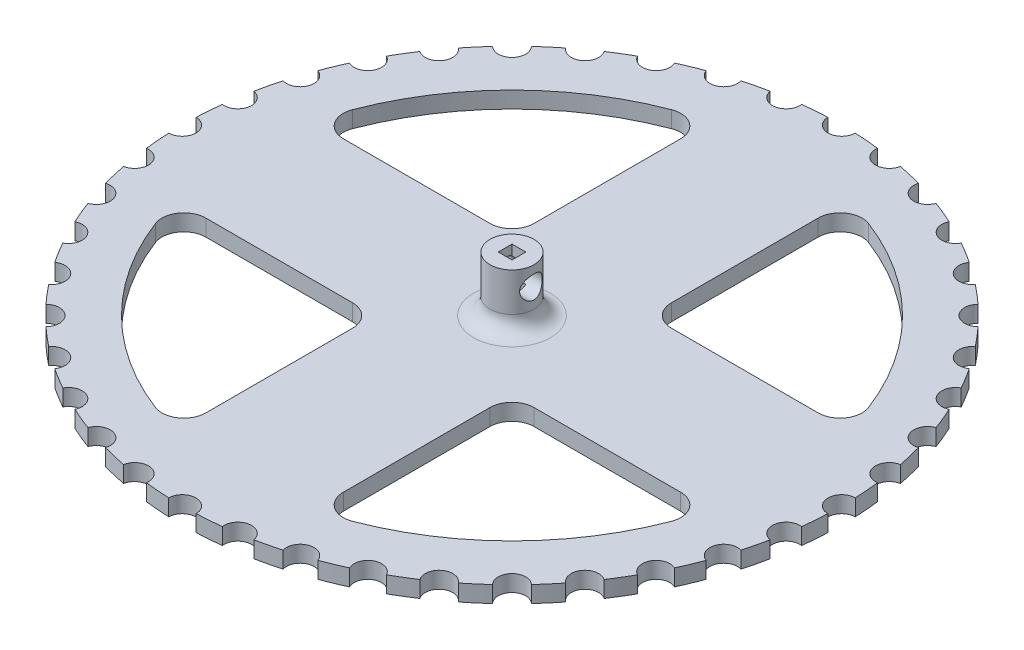
from build123d import *

# Parameters (mm, degrees)
SKETCH1_R           = 76.2
SKETCH1_R_2         = 63.804564168
SKETCH1_R_3         = 15.875
SKETCH1_W           = 3.175
SKETCH1_H           = 3.175
BOSS_EXTRUDE1_DEPTH = 3.81
FILLET1_R           = 5.08
SKETCH2_R           = 5.08
SKETCH2_W           = 3.175
SKETCH2_H           = 3.175
BOSS_EXTRUDE2_DEPTH = 12.7
FILLET2_R           = 3.81
SKETCH3_R           = 2.6
CUT_EXTRUDE1_DEPTH  = 12.7
SKETCH4_R           = 3.175
CUT_EXTRUDE2_DEPTH  = 12.7


with BuildPart() as part:
    # Sketch1 → Boss-Extrude1 (new body)
    # profile 1 of 10: a face of its own
    with BuildSketch(Plane(origin=(0, 0, 0), x_dir=(1, 0, 0), z_dir=(0, 1, 0))):
        with Locations(Location((0, 0, 0), (0, 0, 90))):
            Circle(SKETCH1_R)
        Circle(SKETCH1_R_2, mode=Mode.SUBTRACT)
    # profile 2 of 10: a face of its own
    with BuildSketch(Plane(origin=(0, 0, 0), x_dir=(1, 0, 0), z_dir=(0, 1, 0))):
        with BuildLine():
            Line((-15.875, -15.875), (-15.875, 0))
            Line((-15.875, 0), (-15.875, 15.875))
            Line((-15.875, 15.875), (-61.798113108, 15.875))
            ThreePointArc((-61.798113108, 15.875), (-63.804564168, 0), (-61.798113108, -15.875))
            Line((-61.798113108, -15.875), (-15.875, -15.875))
        make_face()
    # profile 3 of 10: a face of its own
    with BuildSketch(Plane(origin=(0, 0, 0), x_dir=(1, 0, 0), z_dir=(0, 1, 0))):
        with BuildLine():
            Line((0, -15.875), (-15.875, -15.875))
            Line((-15.875, -15.875), (-15.875, -61.798113108))
            ThreePointArc((-15.875, -61.798113108), (0, -63.804564168), (15.875, -61.798113108))
            Line((15.875, -61.798113108), (15.875, -15.875))
            Line((15.875, -15.875), (0, -15.875))
        make_face()
    # profile 4 of 10: a face of its own
    with BuildSketch(Plane(origin=(0, 0, 0), x_dir=(1, 0, 0), z_dir=(0, 1, 0))):
        with BuildLine():
            Line((-15.875, 61.798113108), (-15.875, 15.875))
            Line((-15.875, 15.875), (0, 15.875))
            Line((0, 15.875), (15.875, 15.875))
            Line((15.875, 15.875), (15.875, 61.798113108))
            ThreePointArc((15.875, 61.798113108), (0, 63.804564168), (-15.875, 61.798113108))
        make_face()
    # profile 5 of 10: a face of its own
    with BuildSketch(Plane(origin=(0, 0, 0), x_dir=(1, 0, 0), z_dir=(0, 1, 0))):
        with BuildLine():
            Line((61.798113108, 15.875), (15.875, 15.875))
            Line((15.875, 15.875), (15.875, 0))
            Line((15.875, 0), (15.875, -15.875))
            Line((15.875, -15.875), (61.798113108, -15.875))
            ThreePointArc((61.798113108, -15.875), (63.300963982, -8.000647956), (63.804564168, 0))
            ThreePointArc((63.804564168, 0), (63.300963982, 8.000647956), (61.798113108, 15.875))
        make_face()
    # profile 6 of 10: a face of its own
    with BuildSketch(Plane(origin=(0, 0, 0), x_dir=(1, 0, 0), z_dir=(0, 1, 0))):
        with BuildLine():
            Line((-15.875, 15.875), (-15.875, 0))
            ThreePointArc((-15.875, 0), (-11.225320151, 11.225320151), (0, 15.875))
            Line((0, 15.875), (-15.875, 15.875))
        make_face()
    # profile 7 of 10: a face of its own
    with BuildSketch(Plane(origin=(0, 0, 0), x_dir=(1, 0, 0), z_dir=(0, 1, 0))):
        Circle(SKETCH1_R_3)
        Rectangle(SKETCH1_W, SKETCH1_H, mode=Mode.SUBTRACT)
    # profile 8 of 10: a face of its own
    with BuildSketch(Plane(origin=(0, 0, 0), x_dir=(1, 0, 0), z_dir=(0, 1, 0))):
        with BuildLine():
            ThreePointArc((0, -15.875), (-11.225320151, -11.225320151), (-15.875, 0))
            Line((-15.875, 0), (-15.875, -15.875))
            Line((-15.875, -15.875), (0, -15.875))
        make_face()
    # profile 9 of 10: a face of its own
    with BuildSketch(Plane(origin=(0, 0, 0), x_dir=(1, 0, 0), z_dir=(0, 1, 0))):
        with BuildLine():
            ThreePointArc((15.875, 0), (11.225320151, -11.225320151), (0, -15.875))
            Line((0, -15.875), (15.875, -15.875))
            Line((15.875, -15.875), (15.875, 0))
        make_face()
    # profile 10 of 10: a face of its own
    with BuildSketch(Plane(origin=(0, 0, 0), x_dir=(1, 0, 0), z_dir=(0, 1, 0))):
        with BuildLine():
            Line((15.875, 15.875), (0, 15.875))
            ThreePointArc((0, 15.875), (11.225320151, 11.225320151), (15.875, 0))
            Line((15.875, 0), (15.875, 15.875))
        make_face()
    extrude(amount=BOSS_EXTRUDE1_DEPTH)

    # Fillet1
    fillet1_edges = [part.edges().sort_by_distance(p)[0] for p in [
        (-15.875, 1.905, 15.875),
        (-61.798113108, 1.905, 15.875),
        (-15.875, 1.905, 61.798113108),
        (-61.798113108, 1.905, -15.875),
        (-15.875, 1.905, -15.875),
        (-15.875, 1.905, -61.798113108),
        (15.875, 1.905, 61.798113108),
        (61.798113108, 1.905, 15.875),
        (15.875, 1.905, 15.875),
        (61.798113108, 1.905, -15.875),
        (15.875, 1.905, -61.798113108),
        (15.875, 1.905, -15.875),
    ]]
    fillet(fillet1_edges, radius=FILLET1_R)

    # Sketch2 → Boss-Extrude2 (add)
    with BuildSketch(Plane(origin=(0, 3.81, 0), x_dir=(1, 0, 0), z_dir=(0, 1, 0))):
        with Locations(Location((0, 0, 0), (0, 0, 270))):
            Circle(SKETCH2_R)
        Rectangle(SKETCH2_W, SKETCH2_H, mode=Mode.SUBTRACT)
    extrude(amount=BOSS_EXTRUDE2_DEPTH)

    # Fillet2
    fillet2_edges = [part.edges().sort_by_distance(p)[0] for p in [
        (0, 3.81, -5.08),
    ]]
    fillet(fillet2_edges, radius=FILLET2_R)

    # Sketch3 → Cut-Extrude1 (cut)
    with BuildSketch(Plane.ZY.offset(5.08)):
        with Locations((0, 12.069721832)):
            Circle(SKETCH3_R)
    extrude(amount=-CUT_EXTRUDE1_DEPTH, mode=Mode.SUBTRACT)

    # Sketch4 → Cut-Extrude2 (cut)
    with BuildSketch(Plane(origin=(0, 3.81, 0), x_dir=(1, 0, 0), z_dir=(0, 1, 0))):
        with Locations((0, 76.2)):
            Circle(SKETCH4_R)
        with Locations((11.920306236, 75.261851553)):
            Circle(SKETCH4_R)
        with Locations((23.547094971, 72.470506542)):
            Circle(SKETCH4_R)
        with Locations((34.59407608, 67.894697143)):
            Circle(SKETCH4_R)
        with Locations((44.789236225, 61.647094971)):
            Circle(SKETCH4_R)
        with Locations((53.881536726, 53.881536726)):
            Circle(SKETCH4_R)
        with Locations((61.647094971, 44.789236225)):
            Circle(SKETCH4_R)
        with Locations((67.894697143, 34.59407608)):
            Circle(SKETCH4_R)
        with Locations((72.470506542, 23.547094971)):
            Circle(SKETCH4_R)
        with Locations((75.261851553, 11.920306236)):
            Circle(SKETCH4_R)
        with Locations((76.2, 0)):
            Circle(SKETCH4_R)
        with Locations((75.261851553, -11.920306236)):
            Circle(SKETCH4_R)
        with Locations((72.470506542, -23.547094971)):
            Circle(SKETCH4_R)
        with Locations((67.894697143, -34.59407608)):
            Circle(SKETCH4_R)
        with Locations((61.647094971, -44.789236225)):
            Circle(SKETCH4_R)
        with Locations((53.881536726, -53.881536726)):
            Circle(SKETCH4_R)
        with Locations((44.789236225, -61.647094971)):
            Circle(SKETCH4_R)
        with Locations((34.59407608, -67.894697143)):
            Circle(SKETCH4_R)
        with Locations((23.547094971, -72.470506542)):
            Circle(SKETCH4_R)
        with Locations((11.920306236, -75.261851553)):
            Circle(SKETCH4_R)
        with Locations((0, -76.2)):
            Circle(SKETCH4_R)
        with Locations((-11.920306236, -75.261851553)):
            Circle(SKETCH4_R)
        with Locations((-23.547094971, -72.470506542)):
            Circle(SKETCH4_R)
        with Locations((-34.59407608, -67.894697143)):
            Circle(SKETCH4_R)
        with Locations((-44.789236225, -61.647094971)):
            Circle(SKETCH4_R)
        with Locations((-53.881536726, -53.881536726)):
            Circle(SKETCH4_R)
        with Locations((-61.647094971, -44.789236225)):
            Circle(SKETCH4_R)
        with Locations((-67.894697143, -34.59407608)):
            Circle(SKETCH4_R)
        with Locations((-72.470506542, -23.547094971)):
            Circle(SKETCH4_R)
        with Locations((-75.261851553, -11.920306236)):
            Circle(SKETCH4_R)
        with Locations((-76.2, 0)):
            Circle(SKETCH4_R)
        with Locations((-75.261851553, 11.920306236)):
            Circle(SKETCH4_R)
        with Locations((-72.470506542, 23.547094971)):
            Circle(SKETCH4_R)
        with Locations((-67.894697143, 34.59407608)):
            Circle(SKETCH4_R)
        with Locations((-61.647094971, 44.789236225)):
            Circle(SKETCH4_R)
        with Locations((-53.881536726, 53.881536726)):
            Circle(SKETCH4_R)
        with Locations((-44.789236225, 61.647094971)):
            Circle(SKETCH4_R)
        with Locations((-34.59407608, 67.894697143)):
            Circle(SKETCH4_R)
        with Locations((-23.547094971, 72.470506542)):
            Circle(SKETCH4_R)
        with Locations((-11.920306236, 75.261851553)):
            Circle(SKETCH4_R)
    extrude(amount=-CUT_EXTRUDE2_DEPTH, mode=Mode.SUBTRACT)


solid = part.part
